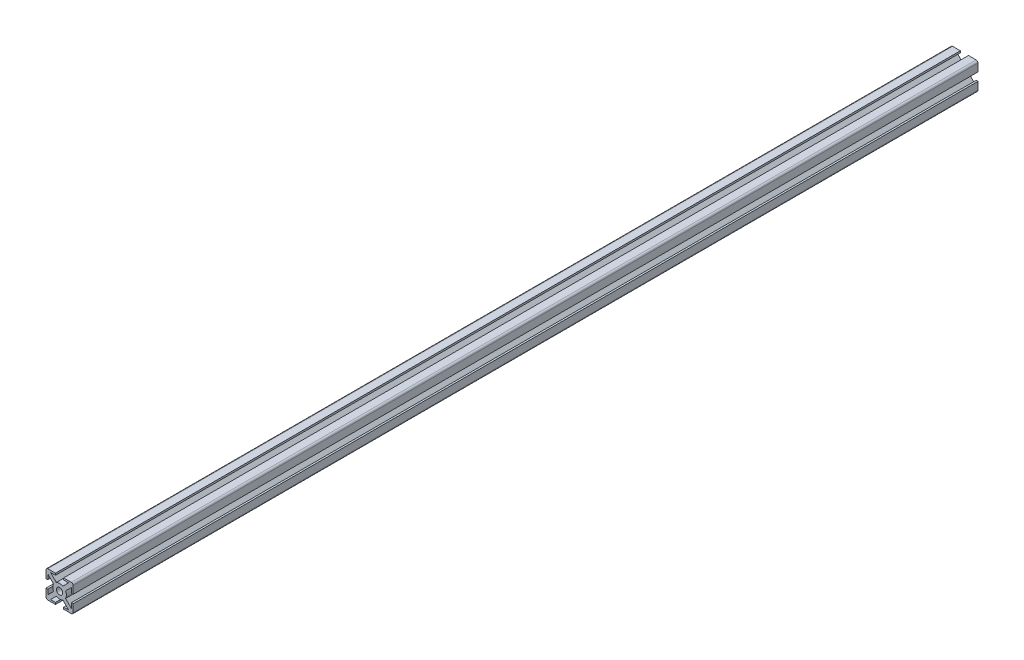
from build123d import *

# Parameters (mm, degrees)
ESBO_O1_R                = 3.5
RESSALTO_EXTRUS_O1_DEPTH = 1000


with BuildPart() as part:
    # Esboço1 → Ressalto-extrusão1 (new body)
    with BuildSketch(Plane.XY):
        with BuildLine():
            Line((-8.822717355, -18.99621233), (-2.409464842, -25.409464842))
            Line((-2.409464842, -25.409464842), (-2.409464842, -19.909464842))
            Line((-2.409464842, -19.909464842), (-0.409464842, -19.909464842))
            Line((-0.409464842, -19.909464842), (-0.409464842, -28.409464842))
            ThreePointArc((-0.409464842, -28.409464842), (-0.99525128, -29.823678405), (-2.409464842, -30.409464842))
            Line((-2.409464842, -30.409464842), (-10.909464842, -30.409464842))
            Line((-10.909464842, -30.409464842), (-10.909464842, -28.409464842))
            Line((-10.909464842, -28.409464842), (-5.409464842, -28.409464842))
            Line((-5.409464842, -28.409464842), (-11.822717355, -21.99621233))
            ThreePointArc((-11.822717355, -21.99621233), (-15.409464842, -22.909464842), (-18.99621233, -21.99621233))
            Line((-18.99621233, -21.99621233), (-25.409464842, -28.409464842))
            Line((-25.409464842, -28.409464842), (-19.909464842, -28.409464842))
            Line((-19.909464842, -28.409464842), (-19.909464842, -30.409464842))
            Line((-19.909464842, -30.409464842), (-28.409464842, -30.409464842))
            ThreePointArc((-28.409464842, -30.409464842), (-29.823678405, -29.823678405), (-30.409464842, -28.409464842))
            Line((-30.409464842, -28.409464842), (-30.409464842, -19.909464842))
            Line((-30.409464842, -19.909464842), (-28.409464842, -19.909464842))
            Line((-28.409464842, -19.909464842), (-28.409464842, -25.409464842))
            Line((-28.409464842, -25.409464842), (-21.99621233, -18.99621233))
            ThreePointArc((-21.99621233, -18.99621233), (-22.909464842, -15.409464842), (-21.99621233, -11.822717355))
            Line((-21.99621233, -11.822717355), (-28.409464842, -5.409464842))
            Line((-28.409464842, -5.409464842), (-28.409464842, -10.909464842))
            Line((-28.409464842, -10.909464842), (-30.409464842, -10.909464842))
            Line((-30.409464842, -10.909464842), (-30.409464842, -2.409464842))
            ThreePointArc((-30.409464842, -2.409464842), (-29.823678405, -0.99525128), (-28.409464842, -0.409464842))
            Line((-28.409464842, -0.409464842), (-19.909464842, -0.409464842))
            Line((-19.909464842, -0.409464842), (-19.909464842, -2.409464842))
            Line((-19.909464842, -2.409464842), (-25.409464842, -2.409464842))
            Line((-25.409464842, -2.409464842), (-18.99621233, -8.822717355))
            ThreePointArc((-18.99621233, -8.822717355), (-15.409464842, -7.909464842), (-11.822717355, -8.822717355))
            Line((-11.822717355, -8.822717355), (-5.409464842, -2.409464842))
            Line((-5.409464842, -2.409464842), (-10.909464842, -2.409464842))
            Line((-10.909464842, -2.409464842), (-10.909464842, -0.409464842))
            Line((-10.909464842, -0.409464842), (-2.409464842, -0.409464842))
            ThreePointArc((-2.409464842, -0.409464842), (-0.99525128, -0.99525128), (-0.409464842, -2.409464842))
            Line((-0.409464842, -2.409464842), (-0.409464842, -10.909464842))
            Line((-0.409464842, -10.909464842), (-2.409464842, -10.909464842))
            Line((-2.409464842, -10.909464842), (-2.409464842, -5.409464842))
            Line((-2.409464842, -5.409464842), (-8.822717355, -11.822717355))
            ThreePointArc((-8.822717355, -11.822717355), (-7.909464842, -15.409464842), (-8.822717355, -18.99621233))
        make_face()
        with Locations((-15.409464842, -15.409464842)):
            Circle(ESBO_O1_R, mode=Mode.SUBTRACT)
    extrude(amount=-RESSALTO_EXTRUS_O1_DEPTH)


solid = part.part
